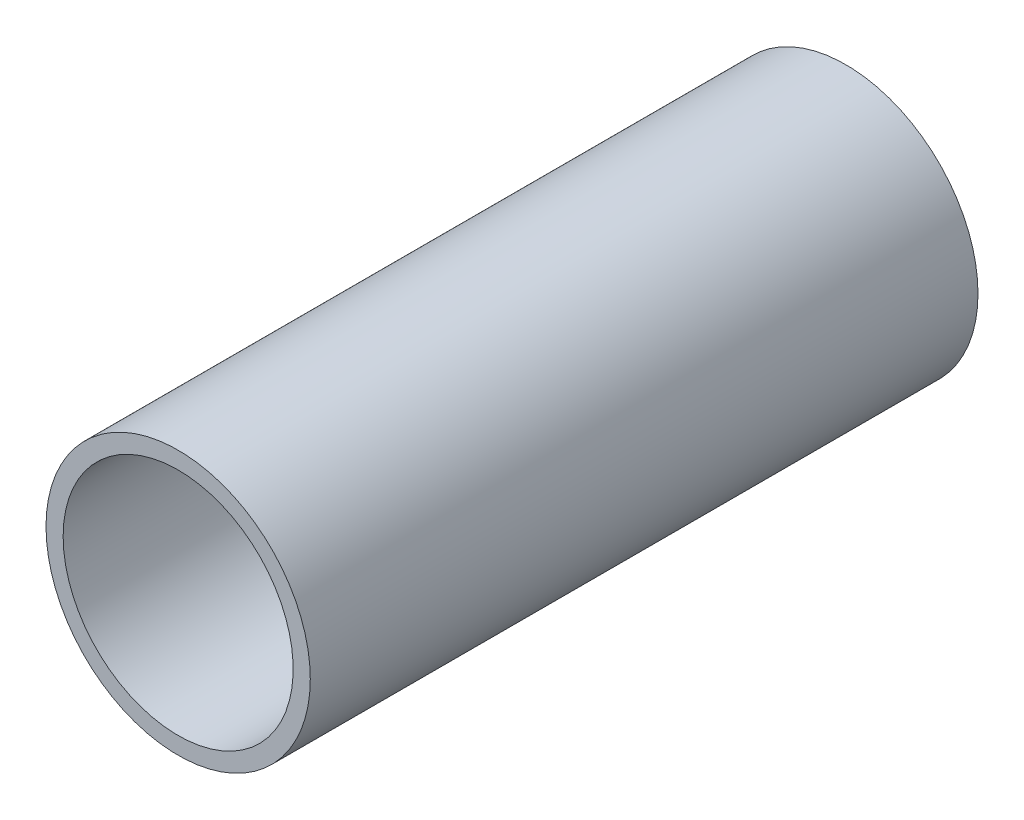
from build123d import *

# Parameters (mm, degrees)
SKETCH1_R           = 30.1625
SKETCH1_R_2         = 26.2509
BOSS_EXTRUDE1_DEPTH = 152.4


with BuildPart() as part:
    # Sketch1 → Boss-Extrude1 (new body)
    with BuildSketch(Plane.XY):
        with Locations(Location((0, 0, 0), (0, 0, 180))):
            Circle(SKETCH1_R)
        with Locations(Location((0, 0, 0), (0, 0, 180))):
            Circle(SKETCH1_R_2, mode=Mode.SUBTRACT)
    extrude(amount=BOSS_EXTRUDE1_DEPTH)


solid = part.part
